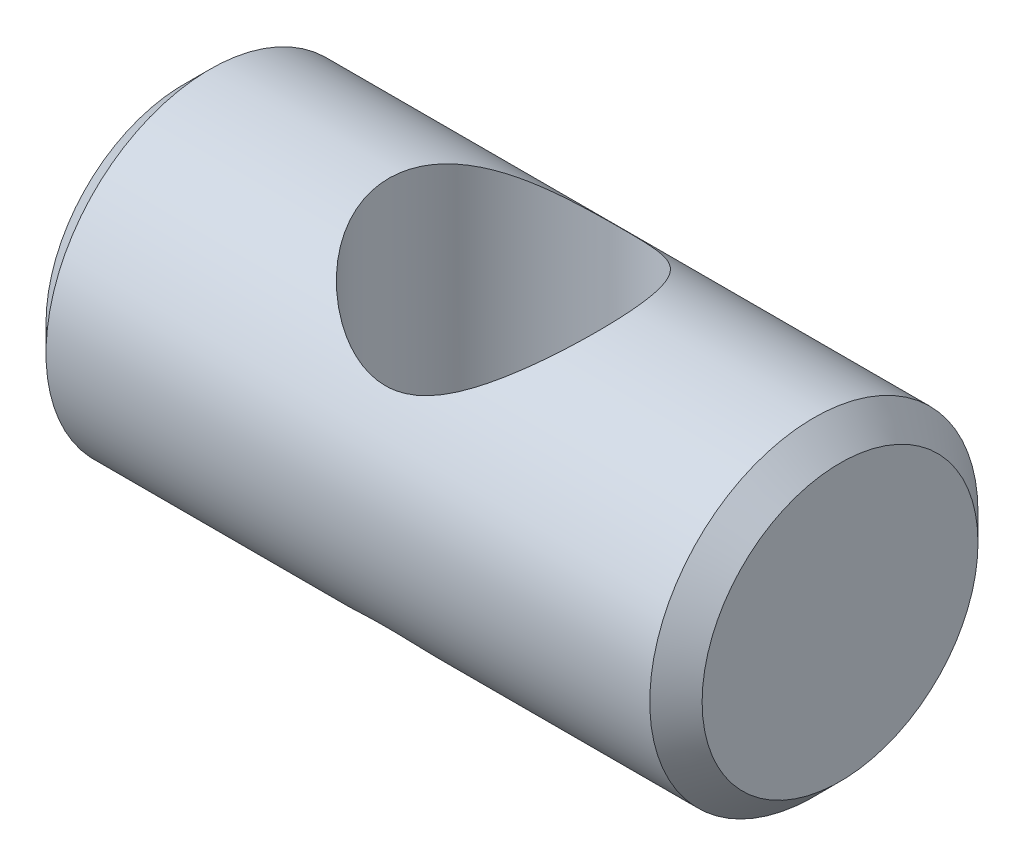
from build123d import *

# Parameters (mm, degrees)
SKETCH1_R               = 4.765
BOSS_EXTRUDE1_DEPTH     = 9.525
CHAMFER1_SIZE           = 0.76
CUT_EXTRUDE1_DEPTH      = 12.667736499
CUT_EXTRUDE1_DEPTH_BACK = 12.667736499
SKETCH2_R               = 3.43


with BuildPart() as part:
    # Sketch1 → Boss-Extrude1 (new, symmetric)
    with BuildSketch(Plane(origin=(0, 0, 0), x_dir=(0, 0, -1), z_dir=(1, 0, 0))):
        with Locations(Location((0, 0, 0), (0, 0, 180))):
            Circle(SKETCH1_R)
    extrude(amount=BOSS_EXTRUDE1_DEPTH, both=True)

    # Chamfer1
    chamfer1_edges = [part.edges().sort_by_distance(p)[0] for p in [
        (-9.525, 0, -4.765),
        (9.525, 0, -4.765),
    ]]
    chamfer(chamfer1_edges, length=CHAMFER1_SIZE)

    # Sketch2 → Cut-Extrude1 (cut, two sides: drawn at the far end of the back side and taken through both)
    with BuildSketch(Plane(origin=(0, 0, 0), x_dir=(1, 0, 0), z_dir=(0, 1, 0)).offset(-CUT_EXTRUDE1_DEPTH_BACK)):
        with Locations(Location((0, -0.25, 0), (0, 0, 270))):
            Circle(SKETCH2_R)
    extrude(amount=CUT_EXTRUDE1_DEPTH + CUT_EXTRUDE1_DEPTH_BACK, mode=Mode.SUBTRACT)


solid = part.part
